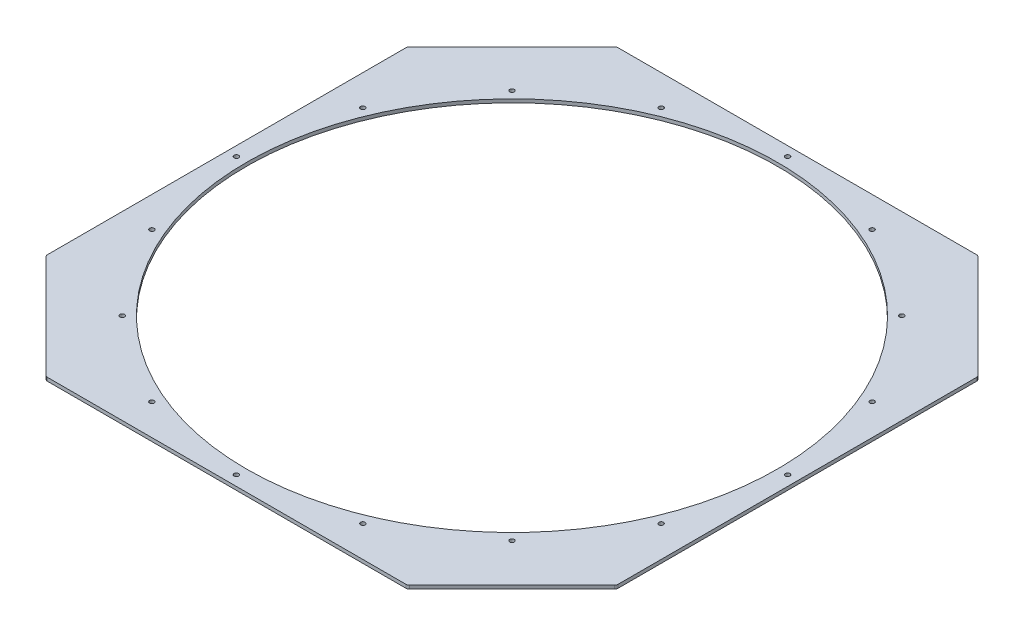
from build123d import *

# Parameters (mm, degrees)
BOSS_EXTRUDE1_DEPTH = 6
SKETCH2_R           = 462.5
CUT_EXTRUDE1_DEPTH  = 10
SKETCH3_R           = 4
CUT_EXTRUDE2_DEPTH  = 10
CIRPATTERN1_COUNT   = 16
FILLET1_R           = 6


with BuildPart() as part:
    # Sketch1 → Boss-Extrude1 (new body)
    with BuildSketch(Plane(origin=(0, 0, 0), x_dir=(1, 0, 0), z_dir=(0, 1, 0))):
        Polygon((315.066450454, 496.5), (497.5, 314.066450454), (497.5, -315.066450454), (315.066450454, -497.5), (-314.066450454, -497.5), (-496.5, -315.066450454), (-496.5, 314.066450454), (-314.066450454, 496.5), align=None)
    extrude(amount=BOSS_EXTRUDE1_DEPTH)

    # Sketch2 → Cut-Extrude1 (cut)
    with BuildSketch(Plane(origin=(0, 6, 0), x_dir=(1, 0, 0), z_dir=(0, 1, 0))):
        with Locations(Location((0, 0, 0), (0, 0, 270))):
            Circle(SKETCH2_R)
    extrude(amount=-CUT_EXTRUDE1_DEPTH, mode=Mode.SUBTRACT)

    # Sketch3 → Cut-Extrude2 (cut)
    with BuildSketch(Plane(origin=(0, 6, 0), x_dir=(1, 0, 0), z_dir=(0, 1, 0))):
        with Locations(Location((0, 480, 0), (0, 0, 270))):
            Circle(SKETCH3_R)
    cut_extrude2 = extrude(amount=-CUT_EXTRUDE2_DEPTH, mode=Mode.SUBTRACT)

    # CirPattern1: Cut-Extrude2 ×16 about axis
    cirpattern1_axis = Axis((0, 0, 0), (0, 1, 0))
    for i in range(1, CIRPATTERN1_COUNT):
        add(cut_extrude2.rotate(cirpattern1_axis, i * 360 / CIRPATTERN1_COUNT), mode=Mode.SUBTRACT)

    # Fillet1
    fillet1_edges = [part.edges().sort_by_distance(p)[0] for p in [
        (315.066450454, 3, -496.5),
        (497.5, 3, -314.066450454),
        (497.5, 3, 315.066450454),
        (315.066450454, 3, 497.5),
        (-314.066450454, 3, 497.5),
        (-496.5, 3, 315.066450454),
        (-496.5, 3, -314.066450454),
        (-314.066450454, 3, -496.5),
    ]]
    fillet(fillet1_edges, radius=FILLET1_R)


solid = part.part
